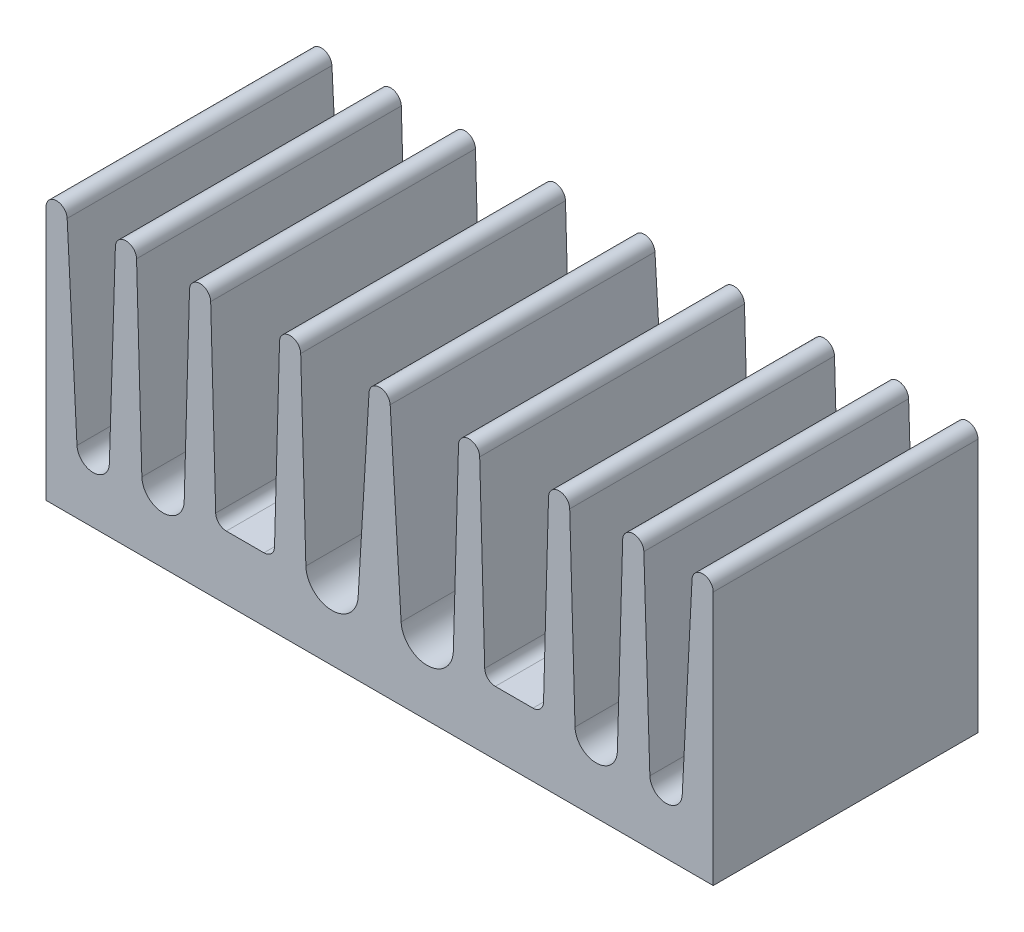
from build123d import *

# Parameters (mm, degrees)
BOSS_EXTRU_1_DEPTH = 25


with BuildPart() as part:
    # Esquisse1 → Boss.-Extru.1 (new body)
    with BuildSketch(Plane.XY):
        with BuildLine():
            Line((20.572515541, 7.900512418), (17.017773047, 7.900512418))
            ThreePointArc((17.017773047, 7.900512418), (16.320544854, 8.183663168), (16.018158033, 8.872766723))
            Line((16.018158033, 8.872766723), (15.544759308, 25.928258114))
            ThreePointArc((15.544759308, 25.928258114), (14.545516715, 26.900512349), (13.545550223, 25.929002661))
            Line((13.545550223, 25.929002661), (13.057346636, 8.800141519))
            ThreePointArc((13.057346636, 8.800141519), (10.626813081, 6.400811923), (8.122740807, 8.723288601))
            Line((8.122740807, 8.723288601), (7.093366706, 25.96257467))
            ThreePointArc((7.093366706, 25.96257467), (6.095144481, 26.90297005), (5.096922241, 25.962574687))
            Line((5.096922241, 25.962574687), (4.067547777, 8.723288571))
            ThreePointArc((4.067547777, 8.723288571), (1.563475481, 6.400811945), (-0.867058048, 8.80014154))
            Line((-0.867058048, 8.80014154), (-1.355261635, 25.929002682))
            ThreePointArc((-1.355261635, 25.929002682), (-2.355228127, 26.90051237), (-3.35447072, 25.928258135))
            Line((-3.35447072, 25.928258135), (-3.827869445, 8.872766744))
            ThreePointArc((-3.827869445, 8.872766744), (-4.130256266, 8.183663189), (-4.827484459, 7.90051244))
            Line((-4.827484459, 7.90051244), (-8.382226953, 7.90051244))
            ThreePointArc((-8.382226953, 7.90051244), (-9.079455146, 8.183663189), (-9.381841967, 8.872766744))
            Line((-9.381841967, 8.872766744), (-9.855240692, 25.928258135))
            ThreePointArc((-9.855240692, 25.928258135), (-10.854483285, 26.90051237), (-11.854449777, 25.929002682))
            Line((-11.854449777, 25.929002682), (-12.355667565, 8.343531954))
            ThreePointArc((-12.355667565, 8.343531954), (-14.354855706, 6.40051244), (-16.354043847, 8.343531954))
            Line((-16.354043847, 8.343531954), (-16.855261635, 25.929002682))
            ThreePointArc((-16.855261635, 25.929002682), (-17.85338443, 26.900511357), (-18.854361615, 25.931943913))
            Line((-18.854361615, 25.931943913), (-19.42196512, 7.882422286))
            ThreePointArc((-19.42196512, 7.882422286), (-20.936113293, 6.400586914), (-22.479206535, 7.852256299))
            Line((-22.479206535, 7.852256299), (-23.406164612, 25.951660244))
            ThreePointArc((-23.406164612, 25.951660244), (-24.430437981, 26.90018516), (-25.404855706, 25.90051244))
            Line((-25.404855706, 25.90051244), (-25.404855706, 1.90051244))
            Line((-25.404855706, 1.90051244), (37.595144294, 1.90051244))
            Line((37.595144294, 1.90051244), (37.595144294, 25.900512418))
            ThreePointArc((37.595144294, 25.900512418), (36.620726569, 26.900185138), (35.5964532, 25.951660223))
            Line((35.5964532, 25.951660223), (34.669495123, 7.852256277))
            ThreePointArc((34.669495123, 7.852256277), (33.126401881, 6.400586892), (31.612253708, 7.882422264))
            Line((31.612253708, 7.882422264), (31.044650203, 25.931943892))
            ThreePointArc((31.044650203, 25.931943892), (30.043673018, 26.900511336), (29.045550223, 25.929002661))
            Line((29.045550223, 25.929002661), (28.544332435, 8.343531933))
            ThreePointArc((28.544332435, 8.343531933), (26.545144294, 6.400512418), (24.545956153, 8.343531933))
            Line((24.545956153, 8.343531933), (24.044738365, 25.929002661))
            ThreePointArc((24.044738365, 25.929002661), (23.044771873, 26.900512349), (22.04552928, 25.928258114))
            Line((22.04552928, 25.928258114), (21.572130555, 8.872766723))
            ThreePointArc((21.572130555, 8.872766723), (21.269743734, 8.183663168), (20.572515541, 7.900512418))
        make_face()
    extrude(amount=BOSS_EXTRU_1_DEPTH)


solid = part.part
